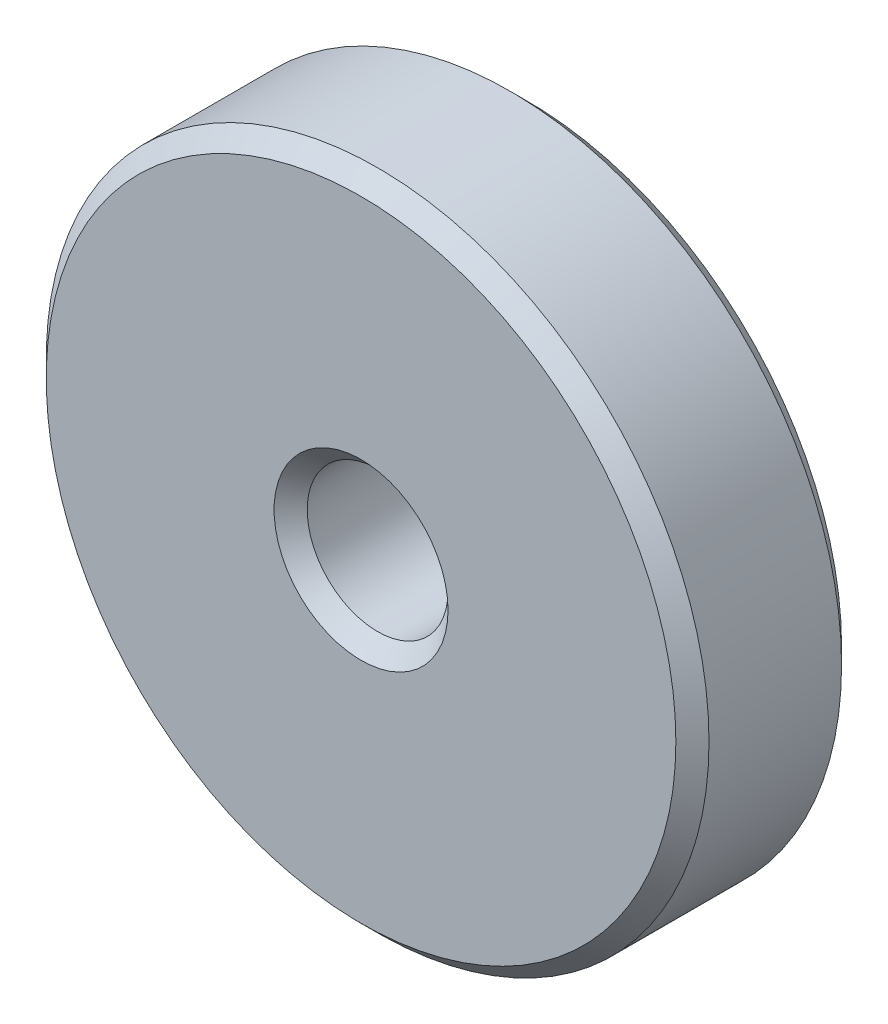
from build123d import *

# Parameters (mm, degrees)
SZKIC1_R                    = 20
SZKIC1_R_2                  = 4.25
DODANIE_WYCI_GNI_CIE1_DEPTH = 10
SFAZOWANIE1_SIZE            = 1


with BuildPart() as part:
    # Szkic1 → Dodanie-wyciągnięcie1 (new body)
    with BuildSketch(Plane.XY):
        Circle(SZKIC1_R)
        Circle(SZKIC1_R_2, mode=Mode.SUBTRACT)
    extrude(amount=DODANIE_WYCI_GNI_CIE1_DEPTH)

    # Sfazowanie1
    sfazowanie1_edges = [part.edges().sort_by_distance(p)[0] for p in [
        (-20, 0, 0),
        (-20, 0, 10),
        (-4.25, 0, 0),
        (-4.25, 0, 10),
    ]]
    chamfer(sfazowanie1_edges, length=SFAZOWANIE1_SIZE)


solid = part.part
